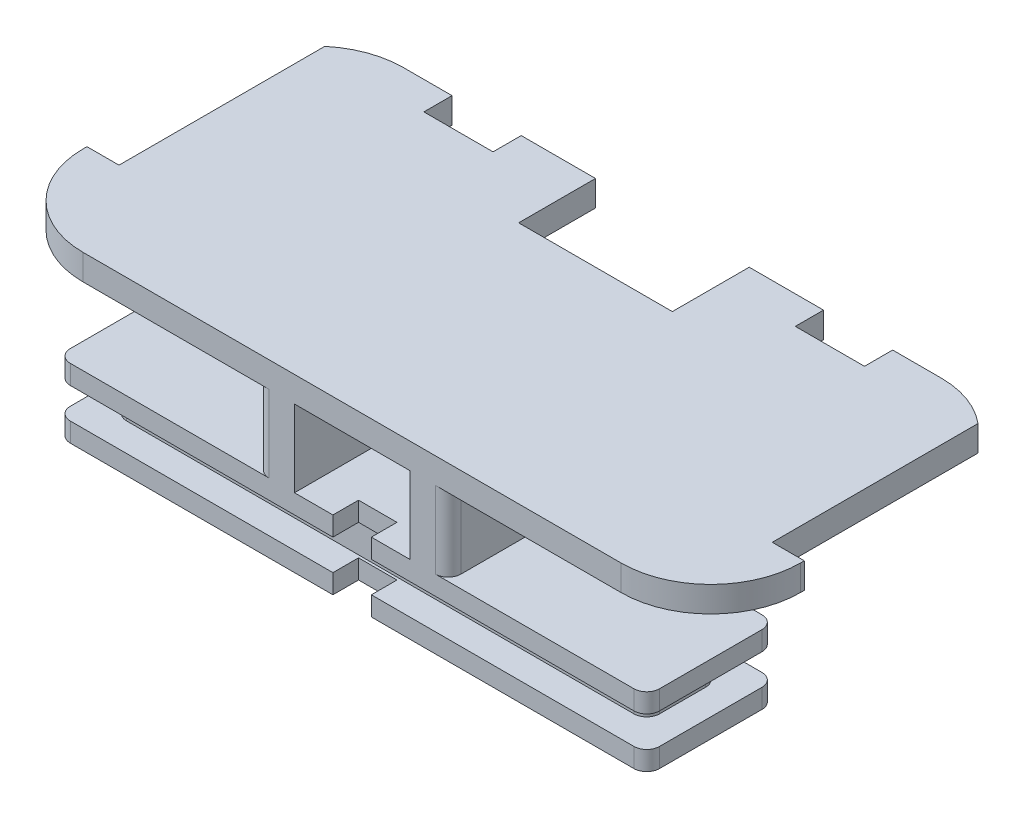
from build123d import *

# Parameters (mm, degrees)
SKETCH1_W           = 46
SKETCH1_H           = 10
BOSS_EXTRUDE1_DEPTH = 1.5
FILLET6_R           = 1
BOSS_EXTRUDE2_REACH = 36.377
SKETCH2_W           = 41.6
SKETCH2_H           = 5.6
SKETCH8_W           = 3
SKETCH8_H           = 10
BOSS_EXTRUDE7_DEPTH = 6
FILLET1_R           = 1
FILLET4_R           = 1
SKETCH4_W           = 56
SKETCH4_H           = 25
BOSS_EXTRUDE5_DEPTH = 2
FILLET7_R           = 7
SKETCH6_W           = 12
SKETCH6_H           = 6
CUT_EXTRUDE1_DEPTH  = 41.014028534
CUT_EXTRUDE2_REACH  = 42.014
SKETCH9_W           = 2.5
SKETCH9_H           = 25
CUT_EXTRUDE3_REACH  = 42.014
SKETCH10_W          = 5.4
SKETCH10_H          = 2.2
SKETCH_1_W          = 3
SKETCH_1_H          = 2
CUT_EXTRUDE_1_DEPTH = 39.542995207


with BuildPart() as part:
    # Sketch1 → Boss-Extrude1 (new body)
    with BuildSketch(Plane(origin=(0, 0, 0), x_dir=(1, 0, 0), z_dir=(0, 1, 0))):
        with Locations((0, -20.249999594)):
            Rectangle(SKETCH1_W, SKETCH1_H)
    extrude(amount=BOSS_EXTRUDE1_DEPTH)

    # Fillet6
    fillet6_edges = [part.edges().sort_by_distance(p)[0] for p in [
        (23, 0.75, 25.249999594),
        (-23, 0.75, 25.249999594),
        (-23, 0.75, 15.249999594),
        (23, 0.75, 15.249999594),
    ]]
    fillet(fillet6_edges, radius=FILLET6_R)


with BuildPart() as body_2:
    # Mirror2: mirrored copy
    add(part.part.mirror(Plane.ZX.offset(-1.2)))

    # Sketch2 → Boss-Extrude2 (add, up to next)
    with BuildSketch(Plane(origin=(0, 0, 0), x_dir=(1, 0, 0), z_dir=(0, 1, 0)), mode=Mode.PRIVATE) as boss_extrude2_sk1:
        with Locations((0, -20.249999594)):
            Rectangle(SKETCH2_W, SKETCH2_H)
    boss_extrude2_tool1 = extrude(boss_extrude2_sk1.sketch, amount=-BOSS_EXTRUDE2_REACH, mode=Mode.PRIVATE) - body_2.part

    add(part.part)  # Boss-Extrude2 merges part
    add(boss_extrude2_tool1.solids().sort_by_distance((0, 0, 20.25))[0])

    # Sketch8 → Boss-Extrude7 (add)
    with BuildSketch(Plane(origin=(0, 1.5, 0), x_dir=(1, 0, 0), z_dir=(0, 1, 0))):
        with Locations((6, -20.249999594)):
            Rectangle(SKETCH8_W, SKETCH8_H)
    extrude(amount=BOSS_EXTRUDE7_DEPTH)

    # Mirror4: body 2 across plane


with BuildPart() as body_2_1:
    add(body_2.part)
    add(body_2.part.mirror(Plane(origin=(0, 0, 0), x_dir=(0, 0, 1), z_dir=(1, 0, 0))))

    # Fillet1
    fillet1_edges = [body_2_1.edges().sort_by_distance(p)[0] for p in [
        (-20.8, -1.2, 17.449999594),
        (20.8, -1.2, 17.449999594),
        (-20.8, -1.2, 23.049999594),
        (20.8, -1.2, 23.049999594),
    ]]
    fillet(fillet1_edges, radius=FILLET1_R)

    # Fillet4
    fillet4_edges = [body_2_1.edges().sort_by_distance(p)[0] for p in [
        (-7.5, 4.5, 15.249999594),
        (7.5, 4.5, 25.249999594),
        (7.5, 4.5, 15.249999594),
        (-7.5, 4.5, 25.249999594),
    ]]
    fillet(fillet4_edges, radius=FILLET4_R)

    # Sketch4 → Boss-Extrude5 (add)
    with BuildSketch(Plane(origin=(0, 7.5, 0), x_dir=(1, 0, 0), z_dir=(0, 1, 0))):
        with Locations((0, -12.749999594)):
            Rectangle(SKETCH4_W, SKETCH4_H)
    extrude(amount=BOSS_EXTRUDE5_DEPTH)

    # Fillet7
    fillet7_edges = [body_2_1.edges().sort_by_distance(p)[0] for p in [
        (-28, 8.5, 0.249999594),
        (-28, 8.5, 25.249999594),
        (28, 8.5, 25.249999594),
        (28, 8.5, 0.249999594),
    ]]
    fillet(fillet7_edges, radius=FILLET7_R)

    # Sketch6 → Cut-Extrude1 (cut, through all)
    with BuildSketch(Plane(origin=(0, 9.5, 0), x_dir=(1, 0, 0), z_dir=(0, 1, 0))):
        with Locations((0, -3.249999594)):
            Rectangle(SKETCH6_W, SKETCH6_H)
    extrude(amount=-CUT_EXTRUDE1_DEPTH, mode=Mode.SUBTRACT)

    # Sketch9 → Cut-Extrude2 (cut, up to next)
    with BuildSketch(Plane(origin=(0, 9.5, 0), x_dir=(1, 0, 0), z_dir=(0, 1, 0)), mode=Mode.PRIVATE) as cut_extrude2_sk1:
        with Locations((-26.75, -5.449999594)):
            Rectangle(SKETCH9_W, SKETCH9_H)
    cut_extrude2_tool1 = extrude(cut_extrude2_sk1.sketch, amount=-CUT_EXTRUDE2_REACH, mode=Mode.PRIVATE) & body_2_1.part
    # Sketch9 → Cut-Extrude2 (cut, up to next)
    with BuildSketch(Plane(origin=(0, 9.5, 0), x_dir=(1, 0, 0), z_dir=(0, 1, 0)), mode=Mode.PRIVATE) as cut_extrude2_sk2:
        with Locations((26.75, -5.449999594)):
            Rectangle(SKETCH9_W, SKETCH9_H)
    cut_extrude2_tool2 = extrude(cut_extrude2_sk2.sketch, amount=-CUT_EXTRUDE2_REACH, mode=Mode.PRIVATE) & body_2_1.part
    add(cut_extrude2_tool1.solids().sort_by_distance((-26.75, 9.5, 5.45))[0], mode=Mode.SUBTRACT)
    add(cut_extrude2_tool2.solids().sort_by_distance((26.75, 9.5, 5.45))[0], mode=Mode.SUBTRACT)

    # Sketch10 → Cut-Extrude3 (cut, up to next)
    with BuildSketch(Plane(origin=(0, 9.5, 0), x_dir=(1, 0, 0), z_dir=(0, 1, 0)), mode=Mode.PRIVATE) as cut_extrude3_sk1:
        with Locations((14.5, -1.349999594)):
            Rectangle(SKETCH10_W, SKETCH10_H)
    cut_extrude3_tool1 = extrude(cut_extrude3_sk1.sketch, amount=-CUT_EXTRUDE3_REACH, mode=Mode.PRIVATE) & body_2_1.part
    # Sketch10 → Cut-Extrude3 (cut, up to next)
    with BuildSketch(Plane(origin=(0, 9.5, 0), x_dir=(1, 0, 0), z_dir=(0, 1, 0)), mode=Mode.PRIVATE) as cut_extrude3_sk2:
        with Locations((-14.5, -1.349999594)):
            Rectangle(SKETCH10_W, SKETCH10_H)
    cut_extrude3_tool2 = extrude(cut_extrude3_sk2.sketch, amount=-CUT_EXTRUDE3_REACH, mode=Mode.PRIVATE) & body_2_1.part
    add(cut_extrude3_tool1.solids().sort_by_distance((14.5, 9.5, 1.35))[0], mode=Mode.SUBTRACT)
    add(cut_extrude3_tool2.solids().sort_by_distance((-14.5, 9.5, 1.35))[0], mode=Mode.SUBTRACT)

    # Эскиз1 → Вырез-Вытянуть1 (cut, through all)
    with BuildSketch(Plane.XZ.offset(-1.5)):
        with Locations((0, 24.249999594)):
            Rectangle(SKETCH_1_W, SKETCH_1_H)
    extrude(amount=CUT_EXTRUDE_1_DEPTH, mode=Mode.SUBTRACT)


solid = body_2_1.part
